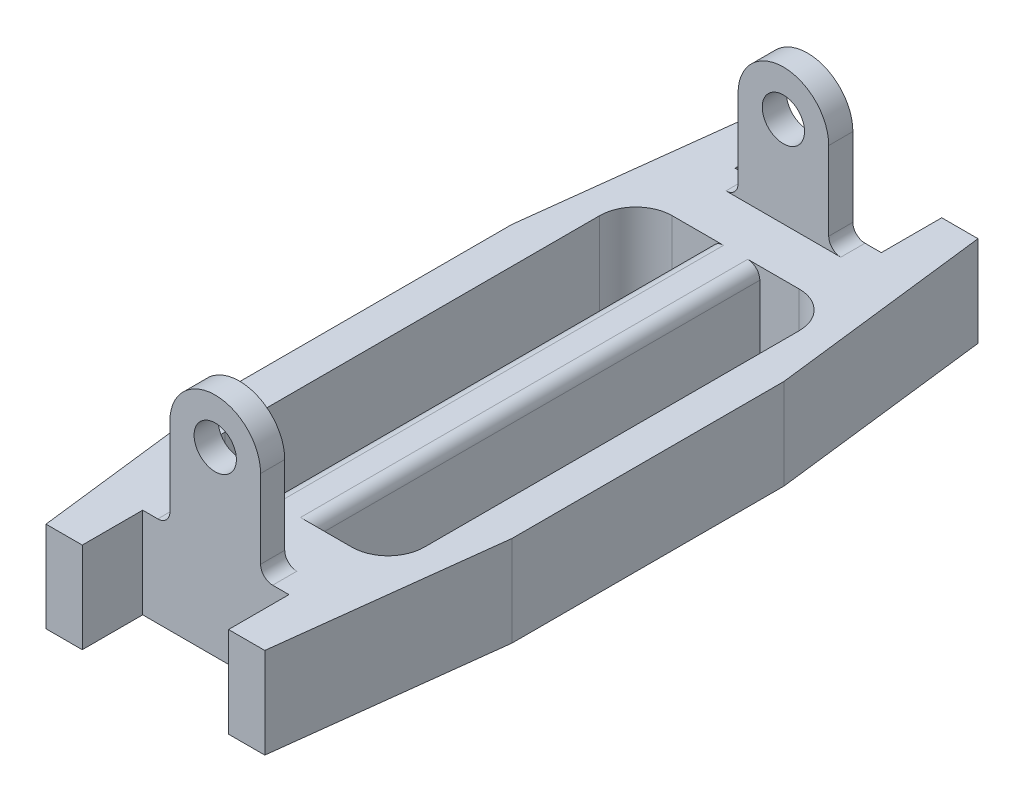
from build123d import *

# Parameters (mm, degrees)
SKETCH1_W           = 16.5
SKETCH1_H           = 16.5
BOSS_EXTRUDE2_DEPTH = 7.5
SKETCH2_W           = 16.5
SKETCH2_H           = 10.25
CUT_EXTRUDE1_DEPTH  = 33.450924486
SKETCH5_W           = 4
SKETCH5_H           = 37
BOSS_EXTRUDE4_DEPTH = 7.5
SKETCH4_R           = 1.75
BOSS_EXTRUDE3_DEPTH = 2
FILLET1_R           = 3
FILLET2_R           = 1
FILLET3_R           = 1


with BuildPart() as part:
    # Sketch1 → Boss-Extrude2 (new body)
    with BuildSketch(Plane(origin=(0, 0, 0), x_dir=(1, 0, 0), z_dir=(0, 1, 0))):
        Polygon((-11.25, -11.25), (-11.25, 11.25), (-9.05, 29.5), (-6.05, 29.5), (-6.05, 24.5), (6.05, 24.5), (6.05, 29.5), (9.05, 29.5), (11.25, 11.25), (11.25, -11.25), (9.05, -29.5), (6.05, -29.5), (6.05, -24.5), (-6.05, -24.5), (-6.05, -29.5), (-9.05, -29.5), align=None)
        Rectangle(SKETCH1_W, SKETCH1_H, mode=Mode.SUBTRACT)
    extrude(amount=BOSS_EXTRUDE2_DEPTH)

    # Sketch2 → Cut-Extrude1 (cut, through all)
    with BuildSketch(Plane(origin=(0, 7.5, 0), x_dir=(1, 0, 0), z_dir=(0, 1, 0))):
        with Locations((0, 13.375)):
            Rectangle(SKETCH2_W, SKETCH2_H)
        with Locations((0, -13.375)):
            Rectangle(SKETCH2_W, SKETCH2_H)
    extrude(amount=-CUT_EXTRUDE1_DEPTH, mode=Mode.SUBTRACT)

    # Sketch5 → Boss-Extrude4 (add)
    with BuildSketch(Plane(origin=(0, 7.5, 0), x_dir=(1, 0, 0), z_dir=(0, 1, 0))):
        Rectangle(SKETCH5_W, SKETCH5_H)
    extrude(amount=-BOSS_EXTRUDE4_DEPTH)

    # Sketch4 → Boss-Extrude3 (add)
    with BuildSketch(Plane.XY.offset(24.5)):
        with BuildLine():
            Line((-3.8, 7.5), (3.7, 7.5))
            Line((3.7, 7.5), (3.7, 15))
            ThreePointArc((3.7, 15), (-0.05, 18.75), (-3.8, 15))
            Line((-3.8, 15), (-3.8, 7.5))
        make_face()
        with Locations((-0.05, 15)):
            Circle(SKETCH4_R, mode=Mode.SUBTRACT)
    boss_extrude3 = extrude(amount=-BOSS_EXTRUDE3_DEPTH)

    # Mirror1: Boss-Extrude3 across plane
    add(boss_extrude3.mirror(Plane.XY))

    # Fillet1
    fillet1_edges = [part.edges().sort_by_distance(p)[0] for p in [
        (-8.25, 3.75, -18.5),
        (8.25, 3.75, -18.5),
        (8.25, 3.75, 18.5),
        (-8.25, 3.75, 18.5),
    ]]
    fillet(fillet1_edges, radius=FILLET1_R)

    # Fillet2
    fillet2_edges = [part.edges().sort_by_distance(p)[0] for p in [
        (-3.8, 7.5, 23.5),
        (3.7, 7.5, 23.5),
        (-3.8, 7.5, -23.5),
        (3.7, 7.5, -23.5),
    ]]
    fillet(fillet2_edges, radius=FILLET2_R)

    # Fillet3
    fillet3_edges = [part.edges().sort_by_distance(p)[0] for p in [
        (-2, 7.5, 0),
        (2, 7.5, 0),
        (-2, 0, 0),
        (2, 0, 0),
    ]]
    fillet(fillet3_edges, radius=FILLET3_R)


solid = part.part
